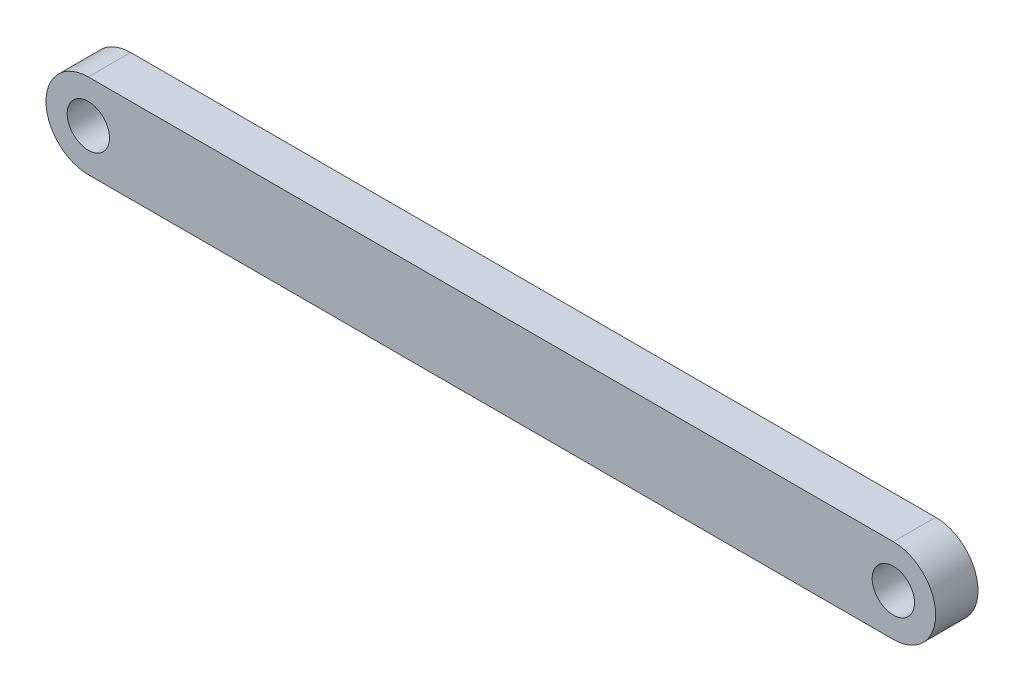
from build123d import *

# Parameters (mm, degrees)
ESBO_O1_R                = 2.5
RESSALTO_EXTRUS_O1_DEPTH = 5


with BuildPart() as part:
    # Esboço1 → Ressalto-extrusão1 (new body)
    with BuildSketch(Plane.XY):
        with BuildLine():
            Line((-45.57, 20.94744466), (49.49, 20.94744466))
            ThreePointArc((49.49, 20.94744466), (54.49, 15.94744466), (49.49, 10.94744466))
            Line((49.49, 10.94744466), (-45.57, 10.94744466))
            ThreePointArc((-45.57, 10.94744466), (-50.57, 15.94744466), (-45.57, 20.94744466))
        make_face()
        with Locations((-45.57, 15.94744466)):
            Circle(ESBO_O1_R, mode=Mode.SUBTRACT)
        with Locations((49.49, 15.94744466)):
            Circle(ESBO_O1_R, mode=Mode.SUBTRACT)
    extrude(amount=RESSALTO_EXTRUS_O1_DEPTH)


solid = part.part
